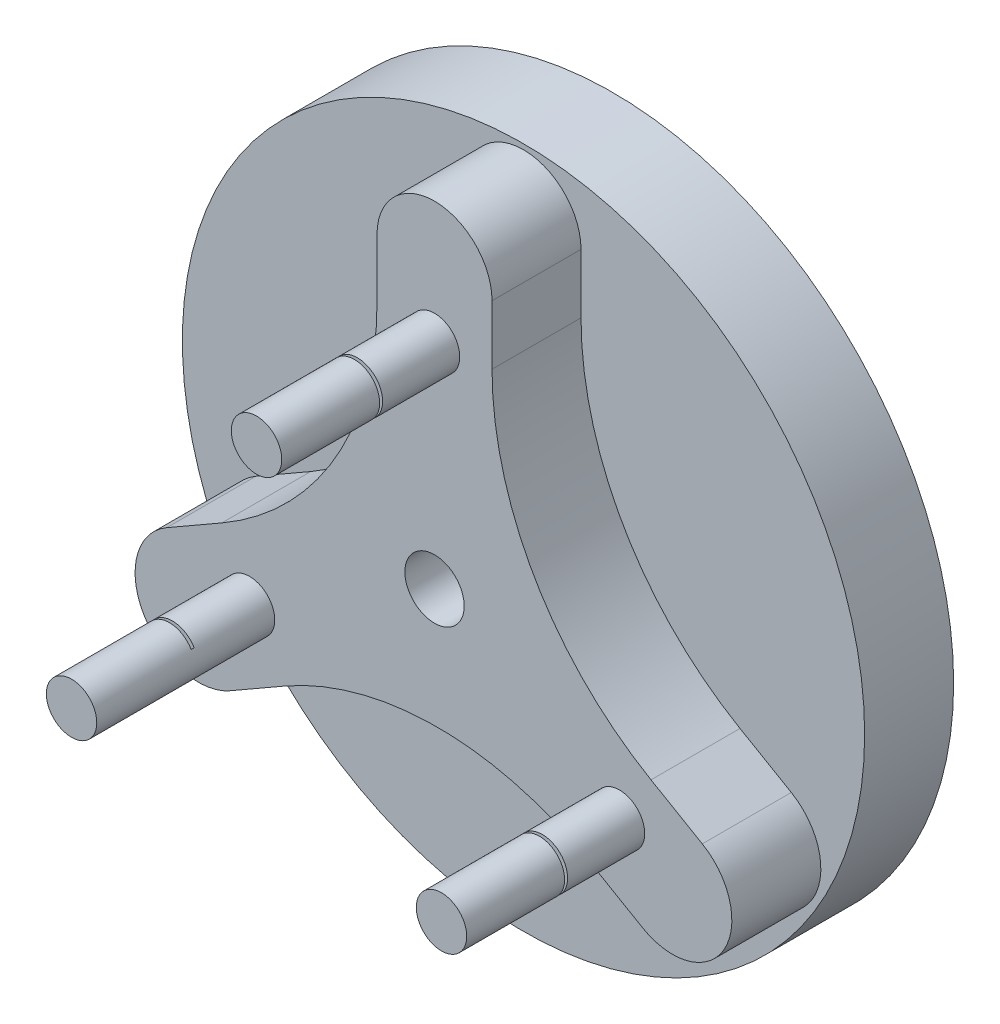
from build123d import *

# Parameters (mm, degrees)
ESQUISSE1_R                  = 115
BOSS_EXTRU_1_DEPTH           = 30
ESQUISSE4_R                  = 10
BOSS_EXTRU_3_DEPTH           = 60
ESQUISSE7_R                  = 8.5
BOSS_EXTRU_4_DEPTH           = 60
R_P_TITION_CIRCULAIRE1_COUNT = 3
ENL_V_START                  = -34
ESQUISSE8_R                  = 8.5
ESQUISSE8_R_2                = 7
ENL_V_MAT_EXTRU_1_DEPTH      = 1
ENL_V_START_2                = -5
ESQUISSE10_R                 = 105
ENL_V_MAT_EXTRU_2_DEPTH      = 20
ECHELLE1_SCALE               = 0.25


with BuildPart() as part:
    # Esquisse1 → Boss.-Extru.1 (new body)
    with BuildSketch(Plane.XY):
        Circle(ESQUISSE1_R)
        with BuildLine():
            Line((-90.226043394, -27.208254638), (-71.724215233, -16.583848882))
            ThreePointArc((-71.724215233, -16.583848882), (-33.409561028, 21.598796439), (-19.383519657, 73.840516299))
            Line((-19.383519657, 73.840516299), (-19.383519657, 93.840516299))
            ThreePointArc((-19.383519657, 93.840516299), (0, 113.224035956), (19.383519657, 93.840516299))
            Line((19.383519657, 93.840516299), (19.383519657, 73.840516299))
            ThreePointArc((19.383519657, 73.840516299), (33.739018197, 20.139465346), (72.975743183, -19.235179086))
            Line((72.975743183, -19.235179086), (90.272811294, -29.275668854))
            ThreePointArc((90.272811294, -29.275668854), (97.529389636, -56.613226732), (70.191831757, -63.869805074))
            Line((70.191831757, -63.869805074), (52.894763647, -53.829315306))
            ThreePointArc((52.894763647, -53.829315306), (1.242076374, -39.859433821), (-50.47540372, -53.587505203))
            Line((-50.47540372, -53.587505203), (-68.97723188, -64.211910959))
            ThreePointArc((-68.97723188, -64.211910959), (-98.103465797, -56.334488555), (-90.226043394, -27.208254638))
        make_face(mode=Mode.SUBTRACT)
    extrude(amount=BOSS_EXTRU_1_DEPTH)

    # Esquisse4 → Boss.-Extru.3 (add)
    with BuildSketch(Plane.XY):
        with BuildLine():
            Line((-90.226043394, -27.208254638), (-71.724215233, -16.583848882))
            ThreePointArc((-71.724215233, -16.583848882), (-33.409561028, 21.598796439), (-19.383519657, 73.840516299))
            Line((-19.383519657, 73.840516299), (-19.383519657, 93.840516299))
            ThreePointArc((-19.383519657, 93.840516299), (0, 113.224035956), (19.383519657, 93.840516299))
            Line((19.383519657, 93.840516299), (19.383519657, 73.840516299))
            ThreePointArc((19.383519657, 73.840516299), (33.739018197, 20.139465346), (72.975743183, -19.235179086))
            Line((72.975743183, -19.235179086), (90.272811294, -29.275668854))
            ThreePointArc((90.272811294, -29.275668854), (97.529389636, -56.613226732), (70.191831757, -63.869805074))
            Line((70.191831757, -63.869805074), (52.894763647, -53.829315306))
            ThreePointArc((52.894763647, -53.829315306), (1.242076374, -39.859433821), (-50.47540372, -53.587505203))
            Line((-50.47540372, -53.587505203), (-68.97723188, -64.211910959))
            ThreePointArc((-68.97723188, -64.211910959), (-98.103465797, -56.334488555), (-90.226043394, -27.208254638))
        make_face()
        with Locations(Location((0, 0, 0), (0, 0, 180))):
            Circle(ESQUISSE4_R, mode=Mode.SUBTRACT)
    extrude(amount=BOSS_EXTRU_3_DEPTH)

    # Esquisse7 → Boss.-Extru.4 (add)
    with BuildSketch(Plane.XY.offset(60)):
        with Locations(Location((0, 72, 0), (0, 0, 180))):
            Circle(ESQUISSE7_R)
    boss_extru_4 = extrude(amount=BOSS_EXTRU_4_DEPTH)

    # Répétition circulaire1: Boss.-Extru.4 ×3 about axis
    r_p_tition_circulaire1_axis = Axis((0, 0, 0), (0, 0, 1))
    for i in range(1, R_P_TITION_CIRCULAIRE1_COUNT):
        add(boss_extru_4.rotate(r_p_tition_circulaire1_axis, i * 360 / R_P_TITION_CIRCULAIRE1_COUNT))

    # Esquisse8 → Enlèv. mat.-Extru.1 (cut)
    # profile 1 of 3: a face of its own
    with BuildSketch(Plane.XY.offset(120).offset(ENL_V_START)):
        with Locations(Location((0, 72, 0), (0, 0, 180))):
            Circle(ESQUISSE8_R)
        with Locations((0, 72)):
            Circle(ESQUISSE8_R_2, mode=Mode.SUBTRACT)
    # profile 2 of 3: a face of its own
    with BuildSketch(Plane.XY.offset(120).offset(ENL_V_START)):
        with Locations((-62.437871739, -35.854039838)):
            Circle(ESQUISSE8_R)
        with Locations((-62.437871739, -35.854039838)):
            Circle(ESQUISSE8_R_2, mode=Mode.SUBTRACT)
    # profile 3 of 3: a face of its own
    with BuildSketch(Plane.XY.offset(120).offset(ENL_V_START)):
        with Locations(Location((62.353829072, -36, 0), (0, 0, 180))):
            Circle(ESQUISSE8_R)
        with Locations((62.353829072, -36)):
            Circle(ESQUISSE8_R_2, mode=Mode.SUBTRACT)
    extrude(amount=ENL_V_MAT_EXTRU_1_DEPTH, mode=Mode.SUBTRACT)

    # Esquisse10 → Enlèv. mat.-Extru.2 (cut)
    with BuildSketch(Plane(origin=(0, 0, 0), x_dir=(-1, 0, 0), z_dir=(0, 0, -1)).offset(ENL_V_START_2)):
        Circle(ESQUISSE10_R)
    extrude(amount=-ENL_V_MAT_EXTRU_2_DEPTH, mode=Mode.SUBTRACT)


with BuildPart() as part_1:
    # Echelle1: scaled about (-0.37502274, -0.313761963, 30.457504843)
    add(part.part.scale(ECHELLE1_SCALE).moved(Location((-0.281267055, -0.235321472, 22.843128632))))


solid = part_1.part
